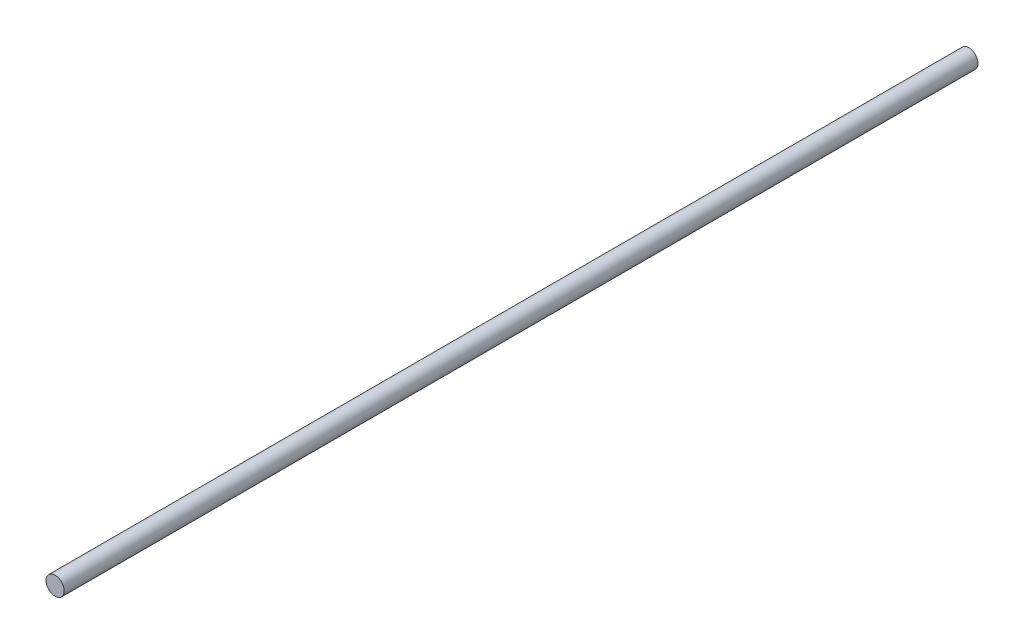
from build123d import *

# Parameters (mm, degrees)
SKETCH_1_R      = 15
EXTRUDE_1_DEPTH = 1500


with BuildPart() as part:
    # ｽｹｯﾁ1 → ﾎﾞｽ - 押し出し1 (new body)
    with BuildSketch(Plane.XY):
        Circle(SKETCH_1_R)
    extrude(amount=EXTRUDE_1_DEPTH)


solid = part.part
